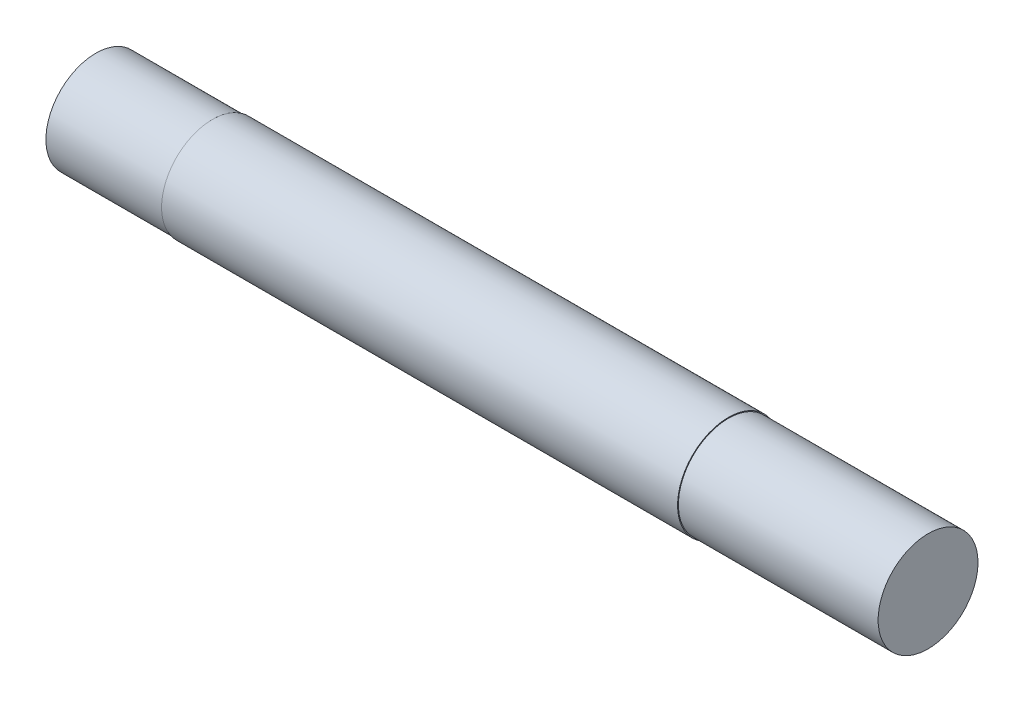
from build123d import *


with BuildPart() as part:
    # Sketch1 → Revolve1 (revolve)
    with BuildSketch(Plane(origin=(0, 0, 0), x_dir=(1, 0, 0), z_dir=(0, 1, 0))):
        Polygon((0, 0), (7, 0), (38, 0), (50, 0), (50, 3), (38, 3), (38, 3.05), (7, 3.05), (7, 3), (0, 3), align=None)
    revolve(axis=Axis((0, 0, 0), (-1, 0, 0)))


solid = part.part
